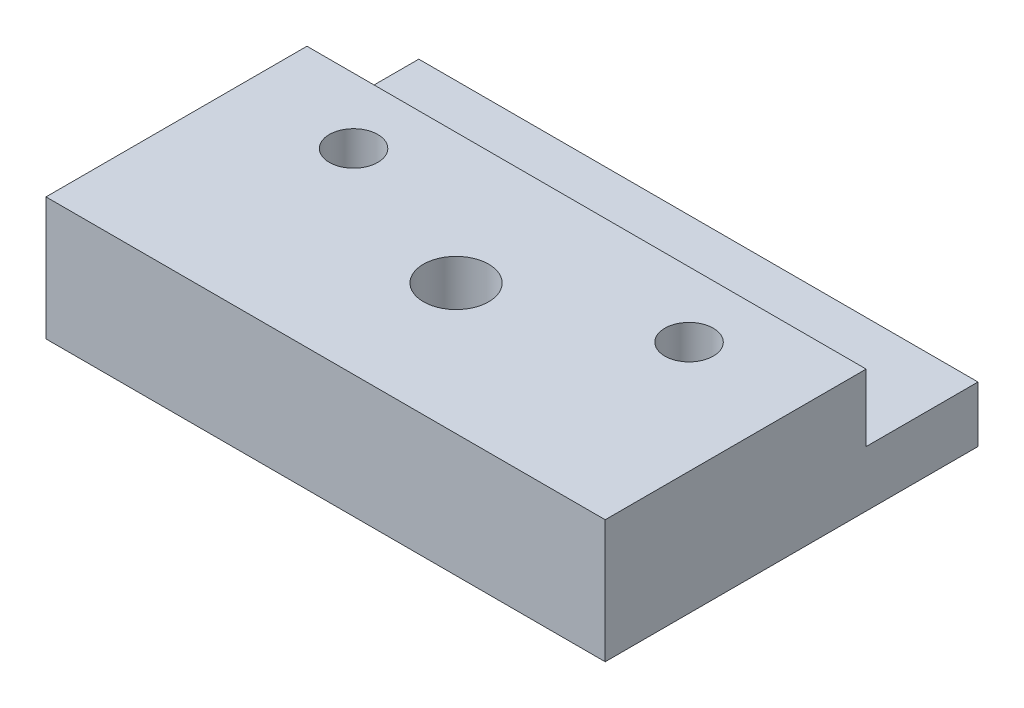
from build123d import *

# Parameters (mm, degrees)
SKETCH_1_W              = 30
SKETCH_1_H              = 20
EXTRUDE_1_DEPTH         = 3
SKETCH_2_W              = 30
SKETCH_2_H              = 14
EXTRUDE_2_DEPTH         = 3.6
HOLE_WIZARD_2_6_2_6_1_D = 2.6
HOLE_WIZARD_3_5_3_5_1_D = 3.5


with BuildPart() as part:
    # 草圖1 → 填料-伸長1 (new body)
    with BuildSketch(Plane(origin=(0, 0, 0), x_dir=(1, 0, 0), z_dir=(0, 1, 0))):
        with Locations((15, 10)):
            Rectangle(SKETCH_1_W, SKETCH_1_H)
    extrude(amount=EXTRUDE_1_DEPTH)

    # 草圖2 → 填料-伸長2 (add)
    with BuildSketch(Plane(origin=(0, 3, 0), x_dir=(1, 0, 0), z_dir=(0, 1, 0))):
        with Locations((15, 7)):
            Rectangle(SKETCH_2_W, SKETCH_2_H)
    extrude(amount=EXTRUDE_2_DEPTH)

    # Ø2.6 (2.6) 直徑孔1 (through all)
    with Locations(Plane(origin=(0, 6.6, 0), x_dir=(1, 0, 0), z_dir=(0, 1, 0))):
        with Locations((6, 10.5), (15, 7), (24, 10.5)):
            Hole(HOLE_WIZARD_2_6_2_6_1_D / 2)

    # Ø3.5 (3.5) 直徑孔1 (through all)
    with Locations(Plane(origin=(0, 6.6, 0), x_dir=(1, 0, 0), z_dir=(0, 1, 0))):
        with Locations((15, 7)):
            Hole(HOLE_WIZARD_3_5_3_5_1_D / 2)


solid = part.part
